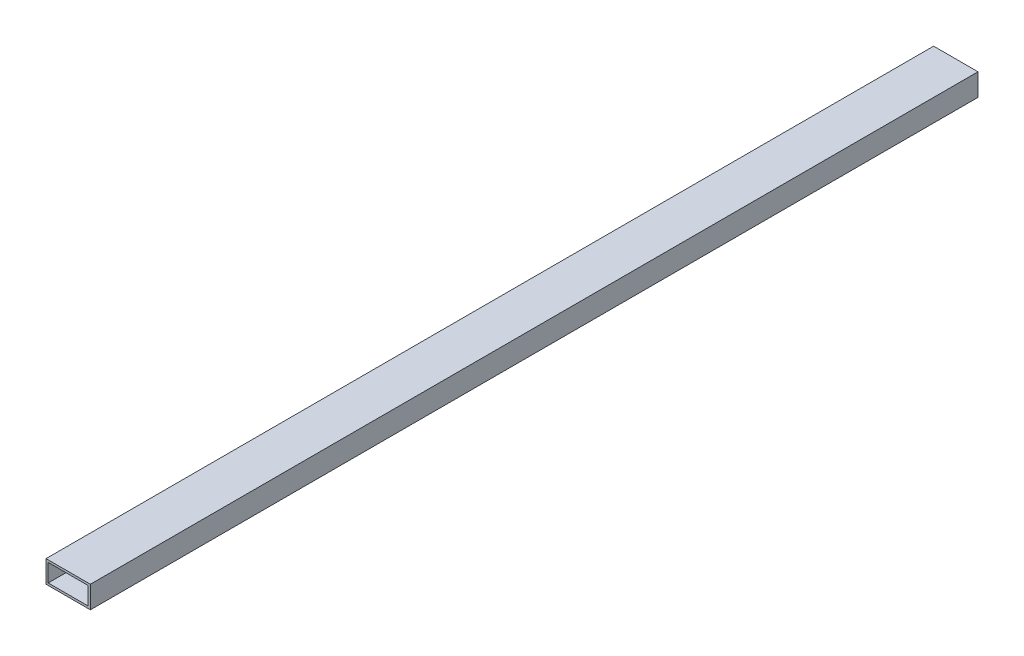
from build123d import *

# Parameters (mm, degrees)
SKETCH_1_W      = 40
SKETCH_1_H      = 20
SKETCH_1_W_2    = 36
SKETCH_1_H_2    = 16
EXTRUDE_1_DEPTH = 800


with BuildPart() as part:
    # Эскиз1 → Бобышка-Вытянуть1 (new body)
    with BuildSketch(Plane.XY):
        with Locations((-12.125455715, -17.360409745)):
            Rectangle(SKETCH_1_W, SKETCH_1_H)
        with Locations((-12.125455715, -17.360409745)):
            Rectangle(SKETCH_1_W_2, SKETCH_1_H_2, mode=Mode.SUBTRACT)
    extrude(amount=EXTRUDE_1_DEPTH)


solid = part.part
